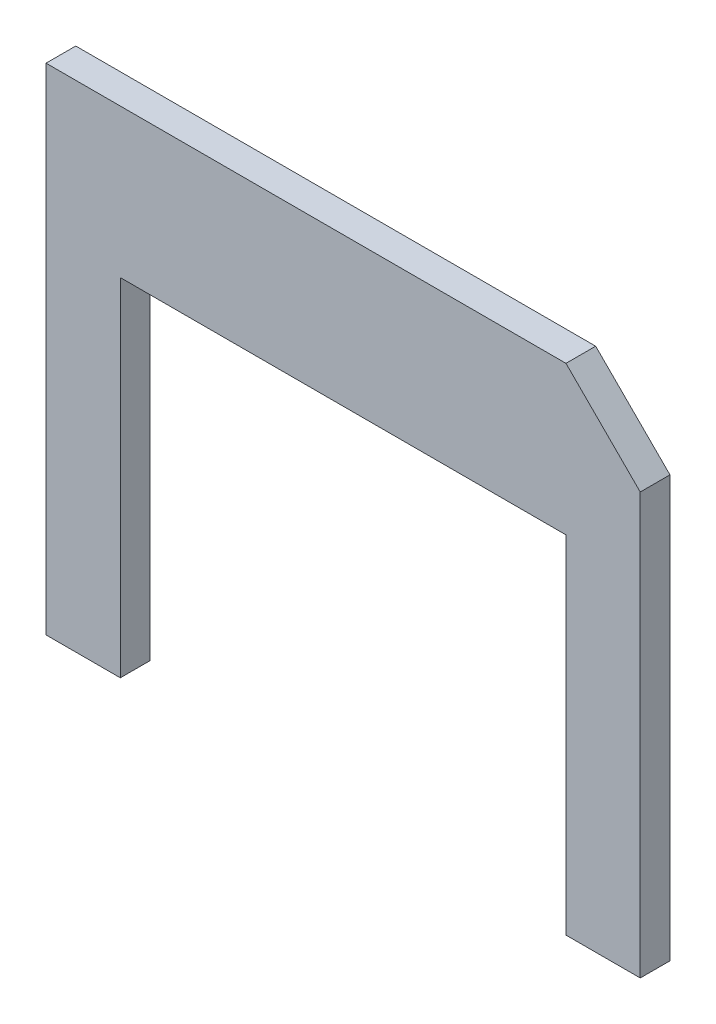
from build123d import *

# Parameters (mm, degrees)
BOSS_EXTRUDE1_DEPTH = 0.6
CUT_EXTRUDE1_DEPTH  = 16.632018424


with BuildPart() as part:
    # Sketch1 → Boss-Extrude1 (new body)
    with BuildSketch(Plane.XY):
        Polygon((0, 0), (0, 10), (12, 10), (12, 0), (10.5, 0), (10.5, 7), (1.5, 7), (1.5, 0), align=None)
    extrude(amount=BOSS_EXTRUDE1_DEPTH)

    # Sketch2 → Cut-Extrude1 (cut, through all)
    with BuildSketch(Plane.XY.offset(0.6)):
        Polygon((10.5, 10), (12, 8.5), (12, 10), align=None)
    extrude(amount=-CUT_EXTRUDE1_DEPTH, mode=Mode.SUBTRACT)


solid = part.part
